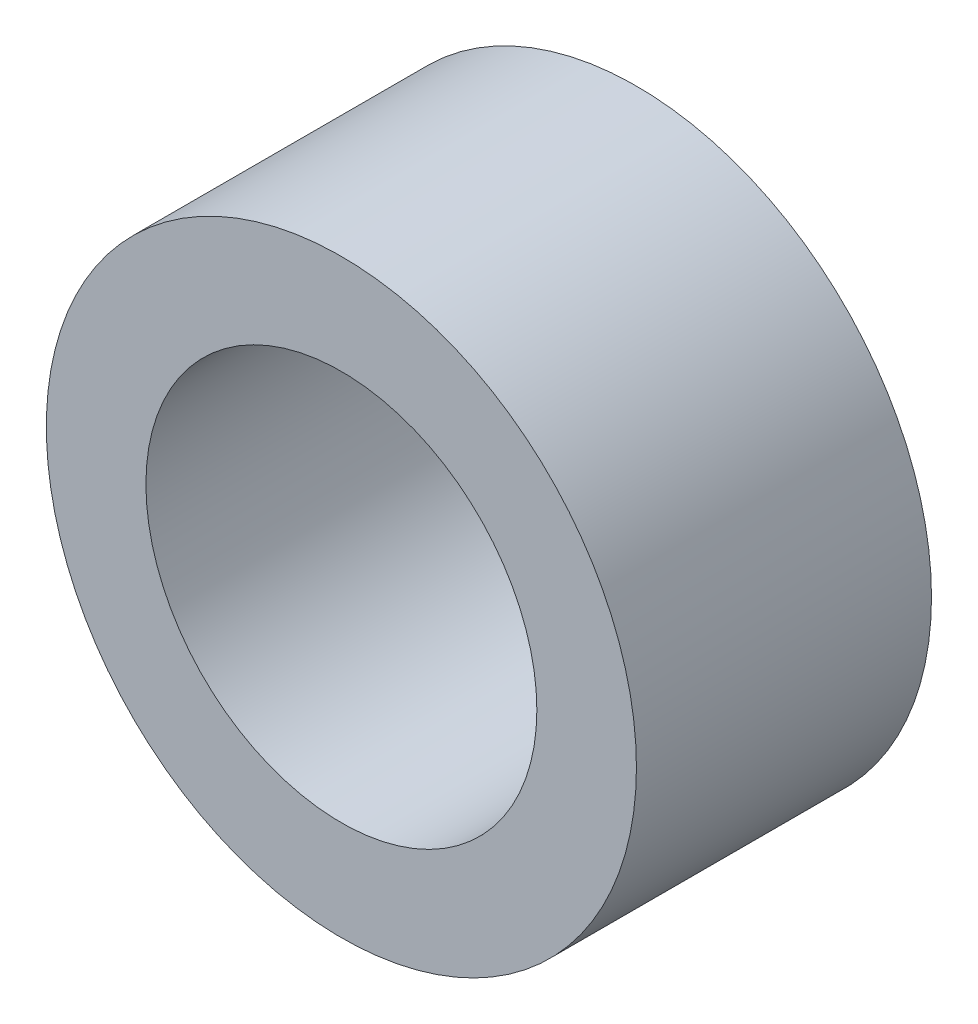
from build123d import *

# Parameters (mm, degrees)
SKETCH1_R      = 4
SKETCH1_R_2    = 2.65
EXTRUDE1_DEPTH = 2


with BuildPart() as part:
    # Sketch1 → Extrude1 (new, symmetric)
    with BuildSketch(Plane.XY):
        Circle(SKETCH1_R)
        Circle(SKETCH1_R_2, mode=Mode.SUBTRACT)
    extrude(amount=EXTRUDE1_DEPTH, both=True)


solid = part.part
